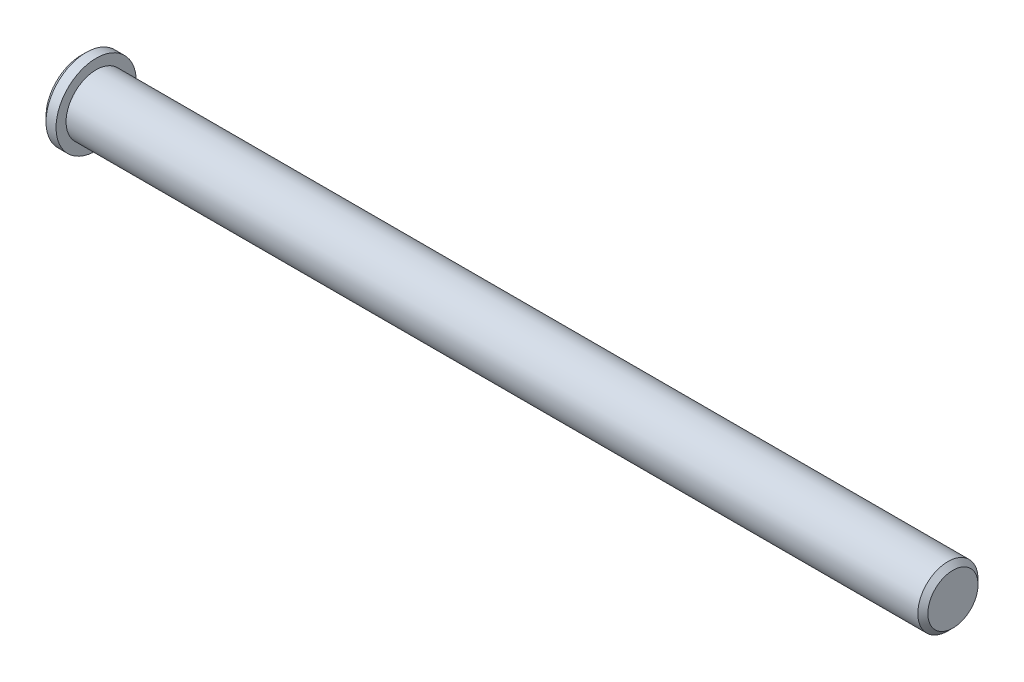
from build123d import *

# Parameters (mm, degrees)
CUT_EXTRUDE1_DEPTH = 4
CHAMFER1_SIZE      = 1


with BuildPart() as part:
    # Sketch1 → Revolve1 (revolve)
    with BuildSketch(Plane.XY):
        Polygon((0, 0), (0, 8), (3, 8), (3, 6), (173.8, 6), (173.8, 0), align=None)
    revolve(axis=Axis((173.8, 0, 0), (-1, 0, 0)))

    # Sketch2 → Cut-Extrude1 (cut)
    with BuildSketch(Plane.ZY):
        Polygon((0, 5), (-4.330127019, 2.5), (-4.330127019, -2.5), (0, -5), (4.330127019, -2.5), (4.330127019, 2.5), align=None)
    extrude(amount=-CUT_EXTRUDE1_DEPTH, mode=Mode.SUBTRACT)

    # Chamfer1
    chamfer1_edges = [part.edges().sort_by_distance(p)[0] for p in [
        (173.8, -6, 0),
        (0, -8, 0),
    ]]
    chamfer(chamfer1_edges, length=CHAMFER1_SIZE)


solid = part.part
